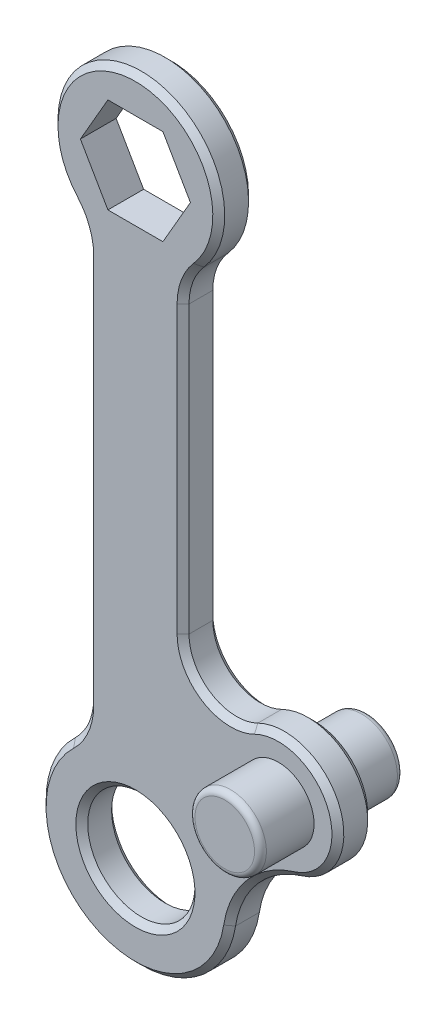
from build123d import *

# Parameters (mm, degrees)
BOSS_EXTRUDE1_DEPTH      = 3
SKETCH2_R                = 4.5
CUT_EXTRUDE1_DEPTH       = 3
BOSS_EXTRUDE4_DEPTH      = 4.5
BOSS_EXTRUDE4_DEPTH_BACK = 7.5
SKETCH2_5_R              = 3
CHAMFER1_SIZE            = 0.5
FILLET1_R                = 0.5


with BuildPart() as part:
    # Sketch1 → Boss-Extrude1 (new body)
    with BuildSketch(Plane.XY):
        with BuildLine():
            Line((-4, 42.062746067), (-4, 9.38083152))
            ThreePointArc((-4, 9.38083152), (-4.400668945, 7.419670168), (-5.538461538, 5.772819397))
            ThreePointArc((-5.538461538, 5.772819397), (-3.688674808, -7.098850481), (7.907374401, -1.213849282))
            ThreePointArc((7.907374401, -1.213849282), (9.761668365, 2.803000933), (13.467211078, 5.220115937))
            ThreePointArc((13.467211078, 5.220115937), (16.64482427, 11.850839674), (9.777777778, 14.479032082))
            ThreePointArc((9.777777778, 14.479032082), (5.891814893, 14.662911406), (4, 18.062257748))
            Line((4, 18.062257748), (4, 42.062746067))
            ThreePointArc((4, 42.062746067), (4.322928267, 43.83051302), (5.25, 45.369935206))
            ThreePointArc((5.25, 45.369935206), (0, 57), (-5.25, 45.369935206))
            ThreePointArc((-5.25, 45.369935206), (-4.322928267, 43.83051302), (-4, 42.062746067))
        make_face()
    extrude(amount=BOSS_EXTRUDE1_DEPTH)

    # Sketch2 → Cut-Extrude1 (cut)
    with BuildSketch(Plane.XY.offset(3)):
        Circle(SKETCH2_R)
        Polygon((4.618802154, 50), (2.309401077, 54), (-2.309401077, 54), (-4.618802154, 50), (-2.309401077, 46), (2.309401077, 46), align=None)
    extrude(amount=-CUT_EXTRUDE1_DEPTH, mode=Mode.SUBTRACT)

    # Chamfer1
    chamfer1_edges = [part.edges().sort_by_distance(p)[0] for p in [
        (4.322928267, 43.83051302, 0),
        (0, 57, 0),
        (4, 30.062501908, 0),
        (-4.322928267, 43.83051302, 0),
        (5.891814893, 14.662911406, 0),
        (-4, 25.721788793, 0),
        (16.64482427, 11.850839674, 0),
        (-4.400668945, 7.419670168, 0),
        (9.761668365, 2.803000933, 0),
        (-3.688674808, -7.098850481, 0),
        (4.322928267, 43.83051302, 3),
        (0, 57, 3),
        (4, 30.062501908, 3),
        (-4.322928267, 43.83051302, 3),
        (5.891814893, 14.662911406, 3),
        (-4, 25.721788793, 3),
        (16.64482427, 11.850839674, 3),
        (-4.400668945, 7.419670168, 3),
        (9.761668365, 2.803000933, 3),
        (-3.688674808, -7.098850481, 3),
        (-4.5, 0, 0),
        (-4.5, 0, 3),
    ]]
    chamfer(chamfer1_edges, length=CHAMFER1_SIZE)


with BuildPart() as body_2:
    # Sketch2<5> → Boss-Extrude4 (new, two sides: drawn at the far end of the back side and taken through both)
    with BuildSketch(Plane.XY.offset(3).offset(-BOSS_EXTRUDE4_DEPTH_BACK)):
        with Locations((12, 10)):
            Circle(SKETCH2_5_R)
    extrude(amount=BOSS_EXTRUDE4_DEPTH + BOSS_EXTRUDE4_DEPTH_BACK)

    # Fillet1
    fillet1_edges = [body_2.edges().sort_by_distance(p)[0] for p in [
        (9, 10, -4.5),
        (9, 10, 7.5),
    ]]
    fillet(fillet1_edges, radius=FILLET1_R)


solid = Compound([part.part, body_2.part])
